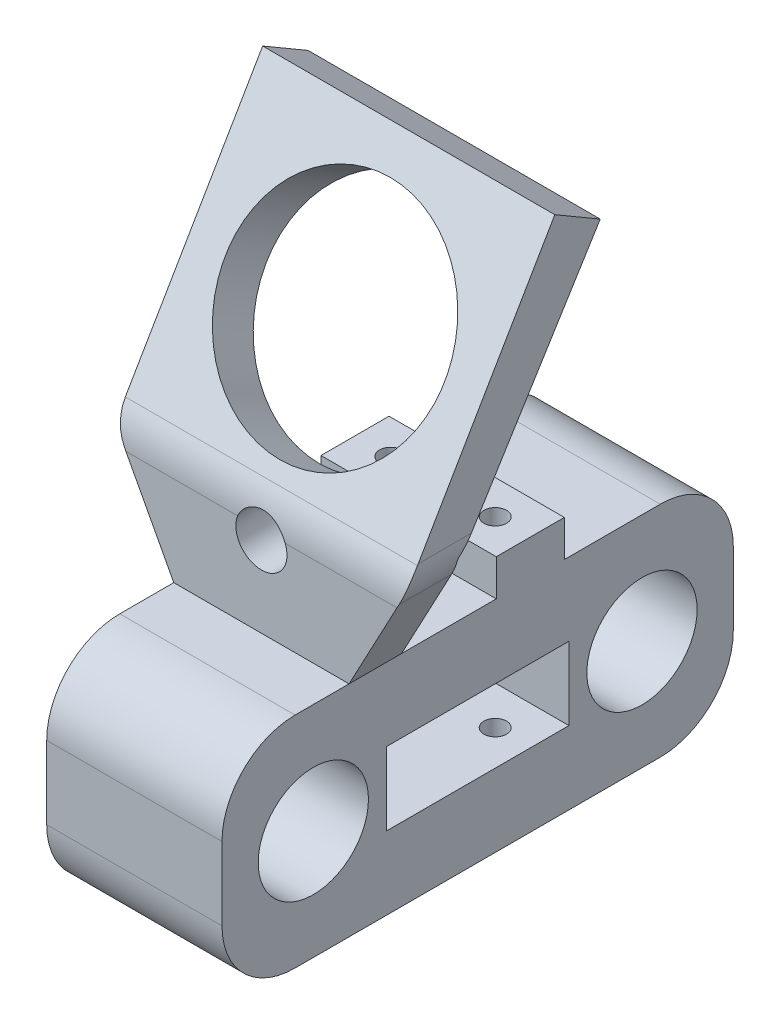
from build123d import *

# Parameters (mm, degrees)
SKETCH_1_W          = 24
SKETCH_1_H          = 70
EXTRUDE_1_DEPTH     = 30
SKETCH_2_R          = 7.55
CUT_EXTRUDE_1_DEPTH = 71.806439045
SKETCH_3_W          = 25
SKETCH_3_H          = 10
CUT_EXTRUDE_2_DEPTH = 71.806439045
SKETCH_4_W          = 24
SKETCH_4_H          = 9.317438099
EXTRUDE_2_DEPTH     = 5
SKETCH_5_R          = 1.55
CUT_EXTRUDE_3_DEPTH = 31
FILLET_1_R          = 10
SKETCH_6_W          = 24
SKETCH_6_H          = 7.198600856
EXTRUDE_3_DEPTH     = 15
EXTRUDE_4_DEPTH     = 24
EXTRUDE_5_DEPTH     = 8
EXTRUDE_6_DEPTH     = 8
SKETCH_10_R         = 15
CUT_EXTRUDE_4_DEPTH = 16
EXTRUDE_7_DEPTH     = 7.198600855
EXTRUDE_8_DEPTH     = 7.198600855
FILLET_2_R          = 10
FILLET_3_R          = 10
SKETCH_14_R         = 3.5
CUT_EXTRUDE_5_DEPTH = 13


with BuildPart() as part:
    # 草图1 → 凸台-拉伸1 (new body)
    with BuildSketch(Plane(origin=(0, 0, 0), x_dir=(1, 0, 0), z_dir=(0, 1, 0))):
        with Locations((20.241900648, -24.477321814)):
            Rectangle(SKETCH_1_W, SKETCH_1_H)
    extrude(amount=EXTRUDE_1_DEPTH)

    # 草图2 → 切除-拉伸1 (cut, through all)
    with BuildSketch(Plane(origin=(32.241900648, 0, 0), x_dir=(0, 0, -1), z_dir=(1, 0, 0))):
        with Locations((-46.977321814, 15)):
            Circle(SKETCH_2_R)
        with Locations((-1.977321814, 15)):
            Circle(SKETCH_2_R)
    extrude(amount=-CUT_EXTRUDE_1_DEPTH, mode=Mode.SUBTRACT)

    # 草图3 → 切除-拉伸2 (cut, through all)
    with BuildSketch(Plane(origin=(32.241900648, 0, 0), x_dir=(0, 0, -1), z_dir=(1, 0, 0))):
        with Locations((-24.477321814, 15)):
            Rectangle(SKETCH_3_W, SKETCH_3_H)
    extrude(amount=-CUT_EXTRUDE_2_DEPTH, mode=Mode.SUBTRACT)

    # 草图4 → 凸台-拉伸2 (add)
    with BuildSketch(Plane(origin=(0, 30, 0), x_dir=(1, 0, 0), z_dir=(0, 1, 0))):
        with Locations((20.241900648, -17.269567559)):
            Rectangle(SKETCH_4_W, SKETCH_4_H)
    extrude(amount=EXTRUDE_2_DEPTH)

    # 草图5 → 切除-拉伸3 (cut)
    with BuildSketch(Plane(origin=(0, 35, 0), x_dir=(1, 0, 0), z_dir=(0, 1, 0))):
        with Locations(Location((27.441174565, -17.269567558, 0), (0, 0, 270))):
            Circle(SKETCH_5_R)
        with Locations(Location((13.141174565, -17.269567558, 0), (0, 0, 270))):
            Circle(SKETCH_5_R)
    extrude(amount=-CUT_EXTRUDE_3_DEPTH, mode=Mode.SUBTRACT)

    # 圆角1
    fillet_1_edges = [part.edges().sort_by_distance(p)[0] for p in [
        (20.241900648, 30, -10.522678186),
        (20.241900648, 0, -10.522678186),
        (20.241900648, 0, 59.477321814),
        (20.241900648, 30, 59.477321814),
    ]]
    fillet(fillet_1_edges, radius=FILLET_1_R)

    # 草图6 → 凸台-拉伸3 (add)
    with BuildSketch(Plane(origin=(0, 30, 0), x_dir=(1, 0, 0), z_dir=(0, 1, 0))):
        with Locations((20.241900648, -38.481509693)):
            Rectangle(SKETCH_6_W, SKETCH_6_H)
    extrude(amount=EXTRUDE_3_DEPTH)

    # 草图7 → 凸台-拉伸4 (add)
    with BuildSketch(Plane.ZY.offset(-8.241900648)):
        Polygon((42.080810121, 45), (21.912574503, 79.54333904), (15.694773475, 75.913056629), (34.882209265, 45), align=None)
    extrude(amount=-EXTRUDE_4_DEPTH)

    # 草图8 → 凸台-拉伸5 (add)
    with BuildSketch(Plane.ZY.offset(-8.241900648)):
        Polygon((42.080810121, 45), (34.882209265, 45), (15.694773475, 75.913056629), (21.912574503, 79.54333904), align=None)
    extrude(amount=EXTRUDE_5_DEPTH)

    # 草图9 → 凸台-拉伸6 (add)
    with BuildSketch(Plane(origin=(32.241900648, 0, 0), x_dir=(0, 0, -1), z_dir=(1, 0, 0))):
        Polygon((-42.080810121, 45), (-34.882209265, 45), (-15.694773475, 75.913056629), (-21.912574503, 79.54333904), align=None)
    extrude(amount=EXTRUDE_6_DEPTH)

    # 草图10 → 切除-拉伸4 (cut)
    with BuildSketch(Plane(origin=(0, 29.763050525, 50.976950321), x_dir=(1, 0, 0), z_dir=(0, 0.5042058904481267, 0.8635834760099408))):
        with Locations(Location((20.241900648, 37.643864083, 0), (0, 0, 270))):
            Circle(SKETCH_10_R)
    extrude(amount=-CUT_EXTRUDE_4_DEPTH, mode=Mode.SUBTRACT)

    # 草图12 → 凸台-拉伸7 (add)
    with BuildSketch(Plane.XY.offset(42.080810121)):
        Polygon((0.241900648, 45), (8.241900648, 45), (8.241900648, 30), align=None)
    extrude(amount=-EXTRUDE_7_DEPTH)

    # 草图13 → 凸台-拉伸8 (add)
    with BuildSketch(Plane.XY.offset(42.080810121)):
        Polygon((40.241900648, 45), (32.241900648, 45), (32.241900648, 30), align=None)
    extrude(amount=-EXTRUDE_8_DEPTH)

    # 圆角2
    fillet_2_edges = [part.edges().sort_by_distance(p)[0] for p in [
        (20.241900648, 45, 42.080810121),
    ]]
    fillet(fillet_2_edges, radius=FILLET_2_R)

    # 圆角3
    fillet_3_edges = [part.edges().sort_by_distance(p)[0] for p in [
        (0.241900648, 45, 38.295029227),
        (40.241900648, 45, 38.295029227),
    ]]
    fillet(fillet_3_edges, radius=FILLET_3_R)

    # 草图14 → 切除-拉伸5 (cut)
    with BuildSketch(Plane.XY.offset(42.080810121)):
        with Locations((20.241537607, 41)):
            Circle(SKETCH_14_R)
    extrude(amount=-CUT_EXTRUDE_5_DEPTH, mode=Mode.SUBTRACT)


solid = part.part
